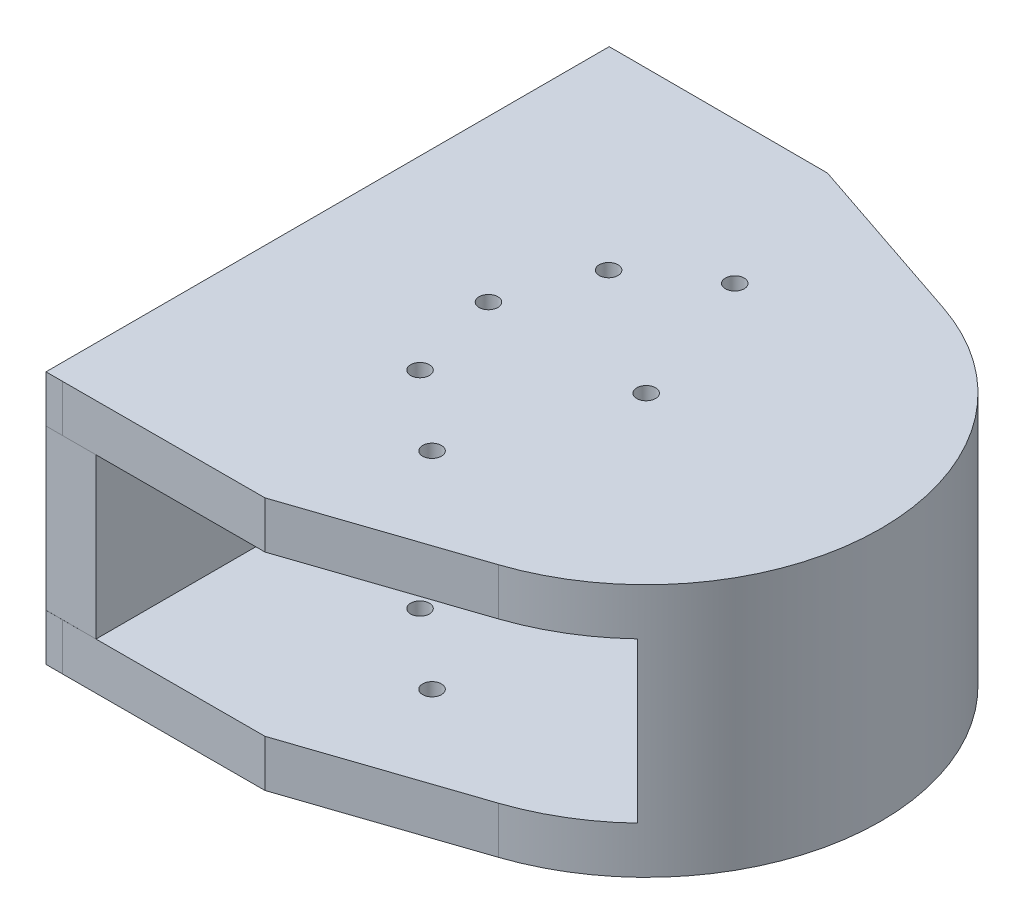
from build123d import *

# Parameters (mm, degrees)
BOSS_EXTRUDE2_DEPTH = 5
SKETCH5_W           = 5.32214827
SKETCH5_H           = 59.994190195
BOSS_EXTRUDE4_DEPTH = 8.5
BOSS_EXTRUDE5_START = 8.5
BOSS_EXTRUDE5_DEPTH = 8.5
SKETCH7_R           = 1
CUT_EXTRUDE1_DEPTH  = 8.5


with BuildPart() as part:
    # Sketch1 → Boss-Extrude2 (new body)
    with BuildSketch(Plane(origin=(0, 0, 0), x_dir=(1, 0, 0), z_dir=(0, 1, 0))):
        with BuildLine():
            Line((-32.160092199, -30), (-28.617759531, -29.994190195))
            Line((-28.617759531, -29.994190195), (-10.646867834, -29.964716006))
            Line((-10.646867834, -29.964716006), (7.978436277, -23.692711001))
            ThreePointArc((7.978436277, -23.692711001), (12.892303289, -21.419349101), (17.201484904, -18.141359296))
            ThreePointArc((17.201484904, -18.141359296), (25, 0), (17.201484904, 18.141359296))
            ThreePointArc((17.201484904, 18.141359296), (12.892303289, 21.419349101), (7.978436277, 23.692711001))
            Line((7.978436277, 23.692711001), (-10.646867834, 29.964716006))
            Line((-10.646867834, 29.964716006), (-27.981736935, 29.994131783))
            Line((-27.981736935, 29.994131783), (-31.439907801, 30))
            Line((-31.439907801, 30), (-33.939907801, 30))
            Line((-33.939907801, 30), (-33.939907801, -30))
            Line((-33.939907801, -30), (-32.160092199, -30))
        make_face()
    extrude(amount=BOSS_EXTRUDE2_DEPTH)

    # Sketch5 → Boss-Extrude4 (add)
    with BuildSketch(Plane.XZ):
        with Locations((-31.278833666, -0.002904903)):
            Rectangle(SKETCH5_W, SKETCH5_H)
    extrude(amount=BOSS_EXTRUDE4_DEPTH)

    # Sketch6 → Boss-Extrude5 (add)
    with BuildSketch(Plane.XZ.offset(BOSS_EXTRUDE5_START)):
        with BuildLine():
            Line((14.793277017, 15.601568994), (17.201484904, 18.141359296))
            ThreePointArc((17.201484904, 18.141359296), (24.999499268, 0.15822873), (17.429740925, -17.92216871))
            Line((17.429740925, -17.92216871), (15.601568994, -14.793277017))
            ThreePointArc((15.601568994, -14.793277017), (21.492401728, 0.571548738), (14.793277017, 15.601568994))
        make_face()
    extrude(amount=-BOSS_EXTRUDE5_DEPTH)

    # Sketch7 → Cut-Extrude1 (cut)
    with BuildSketch(Plane.XZ):
        with Locations(Location((-6.087958551, 16.72652865, 0), (0, 0, 270))):
            Circle(SKETCH7_R)
        with Locations(Location((0, 0, 0), (0, 0, 270))):
            Circle(SKETCH7_R)
        with Locations(Location((-14.171330366, 9.922872349, 0), (0, 0, 270))):
            Circle(SKETCH7_R)
        with Locations(Location((-16.8, 0, 0), (0, 0, 270))):
            Circle(SKETCH7_R)
        with Locations(Location((-13.352178322, -9.349295913, 0), (0, 0, 270))):
            Circle(SKETCH7_R)
        with Locations(Location((-5.403918265, -14.847143408, 0), (0, 0, 270))):
            Circle(SKETCH7_R)
    extrude(amount=-CUT_EXTRUDE1_DEPTH, mode=Mode.SUBTRACT)

    # Mirror1: part across plane


with BuildPart() as part_1:
    add(part.part)
    add(part.part.mirror(Plane.ZX.offset(-8.5)))


solid = part_1.part
